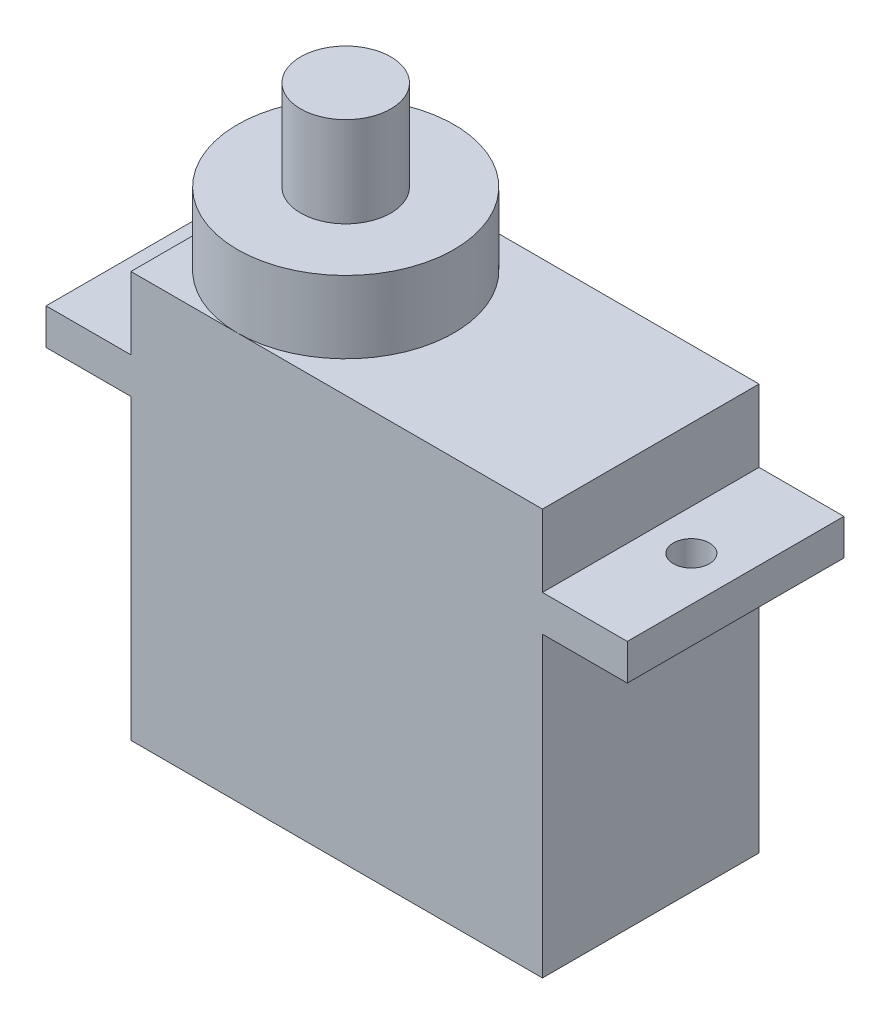
from build123d import *

# Parameters (mm, degrees)
SKETCH1_W           = 22.8
SKETCH1_H           = 12
BOSS_EXTRUDE1_DEPTH = 22.5
SKETCH2_W           = 12
SKETCH2_H           = 2
BOSS_EXTRUDE2_DEPTH = 4.7
SKETCH3_R           = 6
BOSS_EXTRUDE3_DEPTH = 4
SKETCH4_R           = 2.5
BOSS_EXTRUDE4_DEPTH = 5
SKETCH5_R           = 1
CUT_EXTRUDE1_DEPTH  = 5


with BuildPart() as part:
    # Sketch1 → Boss-Extrude1 (new body)
    with BuildSketch(Plane(origin=(0, 0, 0), x_dir=(1, 0, 0), z_dir=(0, 1, 0))):
        Rectangle(SKETCH1_W, SKETCH1_H)
    extrude(amount=BOSS_EXTRUDE1_DEPTH)

    # Sketch2 → Boss-Extrude2 (add)
    with BuildSketch(Plane(origin=(11.4, 0, 0), x_dir=(0, 0, -1), z_dir=(1, 0, 0))):
        with Locations((0, 17.5)):
            Rectangle(SKETCH2_W, SKETCH2_H)
    boss_extrude2 = extrude(amount=BOSS_EXTRUDE2_DEPTH)

    # Mirror1: Boss-Extrude2 across plane
    add(boss_extrude2.mirror(Plane(origin=(0, 0, 0), x_dir=(0, 0, 1), z_dir=(1, 0, 0))))

    # Sketch3 → Boss-Extrude3 (add)
    with BuildSketch(Plane(origin=(0, 22.5, 0), x_dir=(1, 0, 0), z_dir=(0, 1, 0))):
        with Locations(Location((-5.5, 0, 0), (0, 0, 270))):
            Circle(SKETCH3_R)
    extrude(amount=BOSS_EXTRUDE3_DEPTH)

    # Sketch4 → Boss-Extrude4 (add)
    with BuildSketch(Plane(origin=(0, 26.5, 0), x_dir=(1, 0, 0), z_dir=(0, 1, 0))):
        with Locations(Location((-5.5, 0, 0), (0, 0, 270))):
            Circle(SKETCH4_R)
    extrude(amount=BOSS_EXTRUDE4_DEPTH)

    # Sketch5 → Cut-Extrude1 (cut)
    with BuildSketch(Plane(origin=(0, 18.5, 0), x_dir=(1, 0, 0), z_dir=(0, 1, 0))):
        with Locations(Location((13.65, 0, 0), (0, 0, 270))):
            Circle(SKETCH5_R)
    cut_extrude1 = extrude(amount=-CUT_EXTRUDE1_DEPTH, mode=Mode.SUBTRACT)

    # Mirror2: Cut-Extrude1 across plane
    add(cut_extrude1.mirror(Plane(origin=(0, 0, 0), x_dir=(0, 0, 1), z_dir=(1, 0, 0))), mode=Mode.SUBTRACT)


solid = part.part
